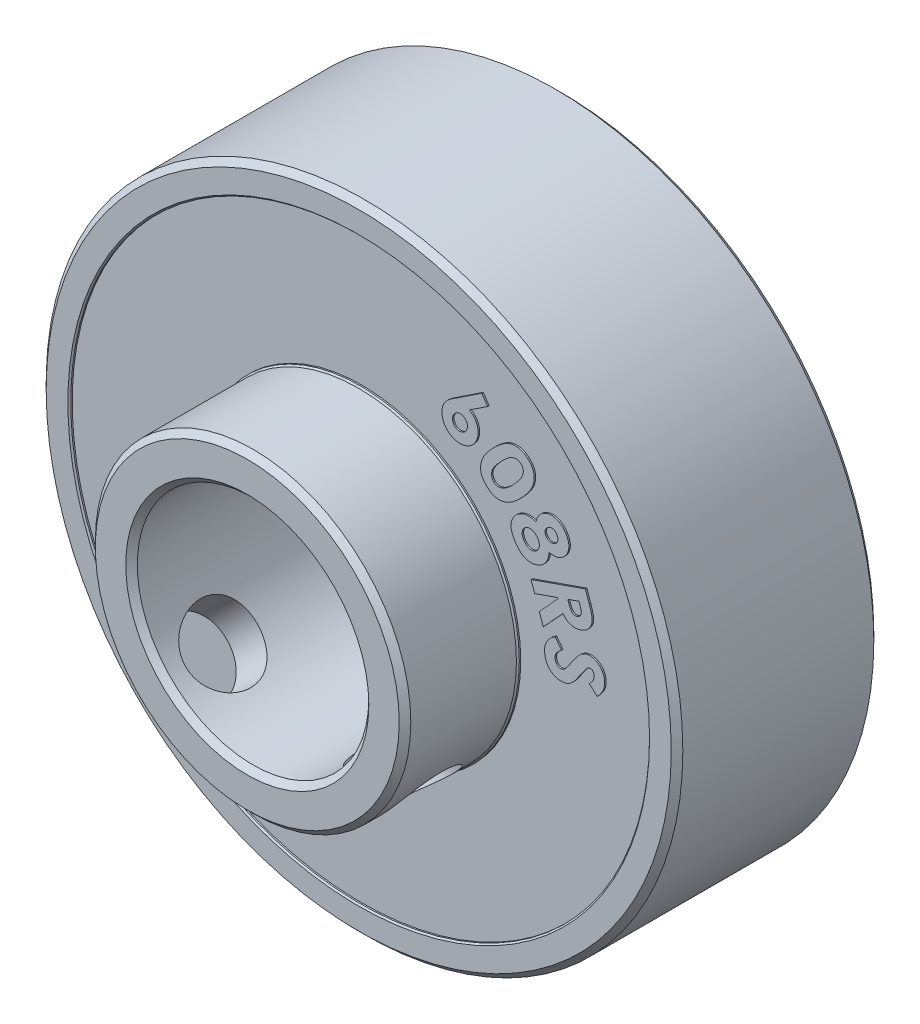
from build123d import *

# Parameters (mm, degrees)
SKETCH_1_R                      = 11
SKETCH_1_R_2                    = 4
EXTRUDE_1_DEPTH                 = 7
SKETCH_2_R                      = 10
SKETCH_2_R_2                    = 5.5
CUT_EXTRUDE_1_DEPTH             = 0.1
CUT_EXTRUDE_START               = -6.9
SKETCH_2_2_R                    = 10
SKETCH_2_2_R_2                  = 5.5
CUT_EXTRUDE_2_DEPTH             = 0.1
CHAMFER_1_SIZE                  = 0.05
SKETCH_3_R                      = 5.45
SKETCH_3_R_2                    = 4
EXTRUDE_2_DEPTH                 = 3.85
EXTRUDE_3_DEPTH                 = 0.05
EXTRUDE_4_DEPTH                 = 0.05
CHAMFER_2_SIZE                  = 0.2
HOLE_WIZARD_M31_D               = 2.5
HOLE_WIZARD_M31_DEPTH           = 5
HOLE_WIZARD_M31_TIP             = 0.751075774
HOLE_WIZARD_M31_ON_FACE_2_D     = 2.5
HOLE_WIZARD_M31_ON_FACE_2_DEPTH = 5
HOLE_WIZARD_M31_ON_FACE_2_TIP   = 0.751075774


with BuildPart() as part:
    # Эскиз1 → Бобышка-Вытянуть1 (new body)
    with BuildSketch(Plane.XY):
        Circle(SKETCH_1_R)
        Circle(SKETCH_1_R_2, mode=Mode.SUBTRACT)
    extrude(amount=EXTRUDE_1_DEPTH)

    # Эскиз2 → Вырез-Вытянуть1 (cut)
    with BuildSketch(Plane.XY.offset(7)):
        Circle(SKETCH_2_R)
        Circle(SKETCH_2_R_2, mode=Mode.SUBTRACT)
    extrude(amount=-CUT_EXTRUDE_1_DEPTH, mode=Mode.SUBTRACT)

    # Эскиз2<2> → Вырез-Вытянуть2 (cut)
    with BuildSketch(Plane.XY.offset(7).offset(CUT_EXTRUDE_START)):
        Circle(SKETCH_2_2_R)
        Circle(SKETCH_2_2_R_2, mode=Mode.SUBTRACT)
    extrude(amount=-CUT_EXTRUDE_2_DEPTH, mode=Mode.SUBTRACT)

    # Фаска1
    chamfer_1_edges = [part.edges().sort_by_distance(p)[0] for p in [
        (-10, 0, 7),
        (-5.5, 0, 7),
        (-10, 0, 0),
        (-5.5, 0, 0),
    ]]
    chamfer(chamfer_1_edges, length=CHAMFER_1_SIZE)

    # Эскиз3 → Бобышка-Вытянуть2 (add)
    with BuildSketch(Plane.XY.offset(7)):
        with Locations(Location((0, 0, 0), (0, 0, 180))):
            Circle(SKETCH_3_R)
        Circle(SKETCH_3_R_2, mode=Mode.SUBTRACT)
    extrude(amount=EXTRUDE_2_DEPTH)

    # Эскиз4 → Бобышка-Вытянуть3 (add)
    # profile 1 of 5: a face of its own
    with BuildSketch(Plane(origin=(0, 0, 0.1), x_dir=(-1, 0, 0), z_dir=(0, 0, -1))):
        with BuildLine():
            Line((8.19029949, 0.296762684), (7.915459746, 0.547964607))
            add(Edge.make_bspline(
                [(7.915459746, 0.547964607), (7.930212538, 0.561652705), (7.958620401, 0.5880104), (7.996327588, 0.629118684), (8.027634521, 0.669973123), (8.052746255, 0.710199301), (8.070948356, 0.750293238), (8.083411061, 0.789625849), (8.08946559, 0.828783287), (8.088037669, 0.854577687), (8.087334746, 0.867275505)],
                knots=[0, 0, 0, 0, 1.283643058, 2.471773221, 3.553897725, 4.563664135, 5.490235735, 6.35533973, 7.190382524, 8, 8, 8, 8], degree=3))
            add(Edge.make_bspline(
                [(8.087334746, 0.867275505), (8.085558773, 0.878973611), (8.082125644, 0.901587192), (8.071279685, 0.933093962), (8.055802359, 0.960805758), (8.03577539, 0.983623568), (8.013683645, 1.002156579), (7.990027468, 1.014988722), (7.965398511, 1.021989278), (7.948884251, 1.021409155), (7.940700131, 1.021121659)],
                knots=[0, 0, 0, 0, 1.207749352, 2.334697242, 3.386348666, 4.431866923, 5.42132409, 6.31922352, 7.167042535, 8, 8, 8, 8], degree=3))
            add(Edge.make_bspline(
                [(7.940700131, 1.021121659), (7.932621335, 1.019788328), (7.916352308, 1.017103275), (7.892835161, 1.008040019), (7.870663256, 0.994639244), (7.857349918, 0.983259209), (7.8505559, 0.977451787)],
                knots=[0, 0, 0, 0, 0.962820743, 1.938922399, 2.948197738, 4, 4, 4, 4], degree=3))
            add(Edge.make_bspline(
                [(7.8505559, 0.977451787), (7.84541126, 0.972172886), (7.833449413, 0.959898867), (7.814987093, 0.937231381), (7.792517843, 0.908811056), (7.766476502, 0.874109426), (7.736487579, 0.833524337), (7.703276191, 0.786289932), (7.666020447, 0.733319385), (7.640427557, 0.695574799), (7.626998208, 0.675769095)],
                knots=[0, 0, 0, 0, 0.470536925, 1.094049535, 1.865251957, 2.784627903, 3.864381354, 5.087794006, 6.471879073, 8, 8, 8, 8], degree=3))
            add(Edge.make_bspline(
                [(7.626998208, 0.675769095), (7.614640541, 0.657163929), (7.59117441, 0.62183434), (7.556915793, 0.572340715), (7.526894203, 0.528161762), (7.500632504, 0.48961279), (7.477330699, 0.457159711), (7.457614111, 0.430479971), (7.44217769, 0.408896208), (7.432465201, 0.396888513), (7.428280259, 0.391714607)],
                knots=[0, 0, 0, 0, 1.545917925, 2.935563431, 4.166209933, 5.243077074, 6.163962197, 6.931235012, 7.539487855, 8, 8, 8, 8], degree=3))
            add(Edge.make_bspline(
                [(7.428280259, 0.391714607), (7.4114759, 0.37182383), (7.379248179, 0.333676916), (7.328208941, 0.282837672), (7.277363857, 0.240609472), (7.226534591, 0.206027725), (7.174108624, 0.179103752), (7.119281824, 0.15825443), (7.061278872, 0.142730866), (7.021175822, 0.137275416), (7.000796284, 0.134503069)],
                knots=[0, 0, 0, 0, 1.216684991, 2.333381793, 3.361974081, 4.302038155, 5.200978211, 6.109832555, 7.039456128, 8, 8, 8, 8], degree=3))
            add(Edge.make_bspline(
                [(7.000796284, 0.134503069), (6.980912016, 0.132939575), (6.941838298, 0.12986722), (6.883982913, 0.131513012), (6.82825067, 0.138661818), (6.774544586, 0.151627333), (6.722756945, 0.169984056), (6.673281438, 0.194236918), (6.625975808, 0.223873764), (6.580966464, 0.258411534), (6.539486787, 0.297912458), (6.502409832, 0.341503294), (6.469838994, 0.388631019), (6.44154117, 0.439372329), (6.418347524, 0.49408404), (6.400061376, 0.552505823), (6.385829599, 0.614394453), (6.380248477, 0.657145995), (6.377398849, 0.678974223)],
                knots=[0, 0, 0, 0, 1.030268607, 2.024536377, 2.985077074, 3.929235972, 4.874504223, 5.819066673, 6.770888815, 7.755188857, 8.746217296, 9.725422457, 10.707590718, 11.702433264, 12.722899079, 13.772838986, 14.862848562, 16, 16, 16, 16], degree=3))
            add(Edge.make_bspline(
                [(6.377398849, 0.678974223), (6.375798997, 0.696321208), (6.372653038, 0.730432429), (6.372535986, 0.781177306), (6.375069038, 0.830462562), (6.381642251, 0.878375858), (6.391261519, 0.924960238), (6.403940592, 0.970331043), (6.420541605, 1.014242388), (6.440615795, 1.056859335), (6.464496118, 1.098276227), (6.491701076, 1.138889291), (6.523102827, 1.178239059), (6.558610982, 1.21622944), (6.597564644, 1.253669069), (6.640451848, 1.289953404), (6.686987923, 1.325474587), (6.720207941, 1.347309565), (6.73717449, 1.358461402)],
                knots=[0, 0, 0, 0, 1.024197967, 2.013989355, 2.98174725, 3.924932278, 4.855438404, 5.777986075, 6.692775885, 7.613415354, 8.545842579, 9.502280528, 10.486163035, 11.50337868, 12.558966263, 13.662340886, 14.806081068, 16, 16, 16, 16], degree=3))
            Line((6.73717449, 1.358461402), (6.961132823, 1.063589607))
            add(Edge.make_bspline(
                [(6.961132823, 1.063589607), (6.941783223, 1.04976002), (6.904640351, 1.023213188), (6.85527869, 0.979883822), (6.813922044, 0.936215765), (6.780990044, 0.891951698), (6.756355029, 0.847119192), (6.740509524, 0.801507386), (6.732160003, 0.755241067), (6.733901828, 0.724403811), (6.734770643, 0.7090223)],
                knots=[0, 0, 0, 0, 1.291115503, 2.478383912, 3.561174717, 4.552019659, 5.467235253, 6.327452426, 7.165739371, 8, 8, 8, 8], degree=3))
            add(Edge.make_bspline(
                [(6.734770643, 0.7090223), (6.737047017, 0.693544477), (6.741454544, 0.663576223), (6.756678186, 0.621468176), (6.778461183, 0.583906059), (6.806966887, 0.552326697), (6.838713363, 0.526585695), (6.873193107, 0.5093839), (6.908924688, 0.499647074), (6.93303441, 0.500608287), (6.945107182, 0.501089607)],
                knots=[0, 0, 0, 0, 1.144864229, 2.216693053, 3.261423878, 4.308950986, 5.319950067, 6.239695352, 7.118540031, 8, 8, 8, 8], degree=3))
            add(Edge.make_bspline(
                [(6.945107182, 0.501089607), (6.956297977, 0.502953883), (6.978992459, 0.50673456), (7.011813893, 0.520227563), (7.043931163, 0.539397657), (7.069731885, 0.560640774), (7.091417844, 0.581581651), (7.109058069, 0.602268001), (7.129286143, 0.626178242), (7.150790557, 0.654455491), (7.174432144, 0.686507292), (7.200054137, 0.722495214), (7.227281408, 0.762582694), (7.245640499, 0.790851961), (7.255203336, 0.805576787)],
                knots=[0, 0, 0, 0, 0.909333767, 1.844092184, 2.830712254, 3.906853886, 4.52164093, 5.251643528, 6.089918518, 7.038804142, 8.105700029, 9.291005529, 10.58894572, 12, 12, 12, 12], degree=3))
            add(Edge.make_bspline(
                [(7.255203336, 0.805576787), (7.273676701, 0.833547949), (7.309135378, 0.88723716), (7.361565684, 0.963513784), (7.411212619, 1.031981061), (7.457727497, 1.093115192), (7.501182872, 1.146904816), (7.541988013, 1.192995836), (7.579505878, 1.231717473), (7.624811187, 1.272495506), (7.680872882, 1.312783201), (7.749093256, 1.350896932), (7.819395634, 1.376597714), (7.867344655, 1.384303781), (7.891020643, 1.388108838)],
                knots=[0, 0, 0, 0, 1.354635275, 2.600152879, 3.740128057, 4.772053465, 5.704282852, 6.533881209, 7.258997855, 7.881984621, 8.994978827, 10.040768623, 11.032582161, 12, 12, 12, 12], degree=3))
            add(Edge.make_bspline(
                [(7.891020643, 1.388108838), (7.907837345, 1.389379919), (7.941058613, 1.391890929), (7.990627945, 1.389771243), (8.038890595, 1.382682444), (8.085784404, 1.369905718), (8.1315722, 1.352830166), (8.175904073, 1.330212525), (8.21850955, 1.302087689), (8.259844147, 1.270033589), (8.298457845, 1.234037671), (8.332687216, 1.194351501), (8.362795003, 1.152283012), (8.388809922, 1.107439648), (8.409857622, 1.05948486), (8.427255893, 1.009050899), (8.43972419, 0.955578355), (8.444613189, 0.918875245), (8.447110387, 0.900128069)],
                knots=[0, 0, 0, 0, 0.982658787, 1.941235034, 2.886113445, 3.821089462, 4.769842375, 5.731008605, 6.715886282, 7.742366117, 8.778049333, 9.788214007, 10.79299206, 11.790714915, 12.805102541, 13.84180981, 14.897641854, 16, 16, 16, 16], degree=3))
            add(Edge.make_bspline(
                [(8.447110387, 0.900128069), (8.448935719, 0.875698903), (8.452568899, 0.827074558), (8.446914222, 0.754085903), (8.432729231, 0.682042073), (8.413680399, 0.622888679), (8.393507869, 0.575406695), (8.374555687, 0.538716982), (8.352421563, 0.500825792), (8.326600844, 0.4621087), (8.297870618, 0.421941161), (8.265169611, 0.381074719), (8.229131565, 0.339066076), (8.203470577, 0.311111175), (8.19029949, 0.296762684)],
                knots=[0, 0, 0, 0, 1.297254647, 2.582083941, 3.866503492, 5.183090301, 5.868268373, 6.599732141, 7.370831279, 8.193636159, 9.066090408, 9.988293336, 10.967445722, 12, 12, 12, 12], degree=3))
        make_face()
    # profile 2 of 5: a face of its own
    with BuildSketch(Plane(origin=(0, 0, 0.1), x_dir=(-1, 0, 0), z_dir=(0, 0, -1))):
        with BuildLine():
            Line((7.783437326, 3.311270875), (7.916049505, 2.931863824))
            add(Edge.make_bspline(
                [(7.916049505, 2.931863824), (7.924769277, 2.906813762), (7.941572283, 2.858542271), (7.963024934, 2.788029468), (7.981292416, 2.722622896), (7.995695135, 2.662213175), (8.006872453, 2.606813373), (8.013669165, 2.556351502), (8.017163917, 2.510850173), (8.016823721, 2.469705288), (8.013181297, 2.4313611), (8.006195484, 2.394738008), (7.9970776, 2.358609232), (7.984653781, 2.323511961), (7.96914369, 2.289215094), (7.951395761, 2.255452582), (7.929654367, 2.223113567), (7.906410686, 2.190975053), (7.879929518, 2.160614922), (7.850983844, 2.132280666), (7.820175082, 2.105381599), (7.786052597, 2.081795139), (7.750622108, 2.058414709), (7.711991084, 2.038403077), (7.671445547, 2.019658329), (7.6431591, 2.00926096), (7.62878989, 2.003979209)],
                knots=[0, 0, 0, 0, 1.706955509, 3.289304765, 4.742725008, 6.076968942, 7.285589652, 8.378391958, 9.352075536, 10.220228812, 11.023312621, 11.827453633, 12.617553708, 13.419486802, 14.219759959, 15.038829142, 15.870829558, 16.725215705, 17.59038548, 18.459516813, 19.331194434, 20.218454335, 21.126861048, 22.061206263, 23.015113666, 24, 24, 24, 24], degree=3))
            add(Edge.make_bspline(
                [(7.62878989, 2.003979209), (7.613633286, 1.998940047), (7.58387039, 1.989044688), (7.538798529, 1.978394979), (7.494653902, 1.970684925), (7.451417635, 1.966152981), (7.40905723, 1.965274454), (7.3676703, 1.968216093), (7.327141762, 1.974045178), (7.287587328, 1.983779464), (7.249163118, 1.997053821), (7.211496131, 2.013653627), (7.174820214, 2.03367515), (7.138912407, 2.056937192), (7.104358371, 2.084204536), (7.070277885, 2.114486214), (7.037441286, 2.148719433), (7.016740509, 2.173330977), (7.006193736, 2.185870234)],
                knots=[0, 0, 0, 0, 1.096708063, 2.153596337, 3.177645909, 4.173531218, 5.136944437, 6.084015114, 7.02072131, 7.946310815, 8.877565628, 9.809949373, 10.770519432, 11.745049659, 12.745151267, 13.791154223, 14.874622174, 16, 16, 16, 16], degree=3))
            Line((7.006193736, 2.185870234), (6.326305916, 1.449091388))
            Line((6.326305916, 1.449091388), (6.189687326, 1.839716388))
            Line((6.189687326, 1.839716388), (6.837123223, 2.541639465))
            Line((6.837123223, 2.541639465), (6.825504634, 2.574492029))
            Line((6.825504634, 2.574492029), (6.029831557, 2.295645875))
            Line((6.029831557, 2.295645875), (5.904831557, 2.653418311))
            Line((5.904831557, 2.653418311), (7.783437326, 3.311270875))
        make_face()
        with BuildLine():
            Line((7.174062326, 2.696286901), (7.213725787, 2.584107414))
            add(Edge.make_bspline(
                [(7.213725787, 2.584107414), (7.218691825, 2.570443194), (7.228199165, 2.544283427), (7.243590818, 2.507335062), (7.25855833, 2.473783305), (7.274594183, 2.444335865), (7.290510547, 2.418541625), (7.306626959, 2.39661665), (7.322900646, 2.378338402), (7.340039177, 2.364089402), (7.357804561, 2.352860045), (7.376557924, 2.344495657), (7.396509399, 2.338777176), (7.417431195, 2.335993291), (7.439480594, 2.33620775), (7.462604378, 2.33850186), (7.486837126, 2.343916635), (7.503026628, 2.349069729), (7.511402069, 2.351735619)],
                knots=[0, 0, 0, 0, 1.601891661, 3.066776947, 4.410195398, 5.648149463, 6.758846487, 7.747826659, 8.643734474, 9.448322519, 10.195548691, 10.953137507, 11.703112172, 12.475283592, 13.269985724, 14.128109779, 15.031600479, 16, 16, 16, 16], degree=3))
            add(Edge.make_bspline(
                [(7.511402069, 2.351735619), (7.521147096, 2.35559951), (7.540209085, 2.363157563), (7.566074549, 2.378945612), (7.588463677, 2.398071694), (7.607385114, 2.420242858), (7.622629573, 2.444952802), (7.633390541, 2.471694709), (7.640549153, 2.499855194), (7.642219977, 2.524775568), (7.641954507, 2.546526319), (7.639054197, 2.565454062), (7.635740431, 2.587201882), (7.629849179, 2.61128605), (7.623047983, 2.638033071), (7.614660766, 2.667347576), (7.60409895, 2.699141683), (7.596615811, 2.721264102), (7.592732198, 2.732745234)],
                knots=[0, 0, 0, 0, 1.127833703, 2.206125587, 3.247006354, 4.287887121, 5.334123575, 6.360081624, 7.382502748, 8.450668697, 9.040729981, 9.722428417, 10.510067932, 11.410520644, 12.39108699, 13.483965865, 14.694224073, 16, 16, 16, 16], degree=3))
            Line((7.592732198, 2.732745234), (7.558277069, 2.830902286))
            Line((7.558277069, 2.830902286), (7.174062326, 2.696286901))
        make_face(mode=Mode.SUBTRACT)
    # profile 3 of 5: a face of its own
    with BuildSketch(Plane(origin=(0, 0, 0.1), x_dir=(-1, 0, 0), z_dir=(0, 0, -1))):
        with BuildLine():
            add(Edge.make_bspline(
                [(6.524956198, 3.777500663), (6.524304606, 3.75126623), (6.523019287, 3.69951662), (6.509214831, 3.623469832), (6.486888654, 3.550377208), (6.454692656, 3.481106031), (6.414135167, 3.416737269), (6.366520042, 3.357464227), (6.311106445, 3.304622347), (6.269210325, 3.275126123), (6.24811325, 3.260273099)],
                knots=[0, 0, 0, 0, 1.027340805, 2.026515475, 3.018313015, 4.016060567, 5.010961512, 5.993641018, 6.989684333, 8, 8, 8, 8], degree=3))
            add(Edge.make_bspline(
                [(6.24811325, 3.260273099), (6.224201635, 3.24561151), (6.17684081, 3.216571858), (6.099236998, 3.186803655), (6.01938164, 3.165575641), (5.937038073, 3.156819994), (5.855027357, 3.158202871), (5.775198976, 3.170467796), (5.699052471, 3.194578876), (5.638722513, 3.223379802), (5.592328757, 3.251989183), (5.558324524, 3.277540386), (5.524468605, 3.306017131), (5.491500637, 3.338079993), (5.458736035, 3.37313351), (5.426897068, 3.411715615), (5.394976108, 3.453295723), (5.375210263, 3.483040176), (5.365100429, 3.498253869)],
                knots=[0, 0, 0, 0, 1.303214694, 2.581227698, 3.852387222, 5.141062064, 6.422020446, 7.661855004, 8.886870759, 10.127110528, 10.763715695, 11.421492558, 12.105285765, 12.821976999, 13.560998413, 14.337908647, 15.149873567, 16, 16, 16, 16], degree=3))
            add(Edge.make_bspline(
                [(5.365100429, 3.498253869), (5.354502757, 3.514704801), (5.333927015, 3.546644847), (5.306890227, 3.595047921), (5.282338511, 3.641528806), (5.262354463, 3.687127168), (5.244439697, 3.730923542), (5.231573515, 3.773839499), (5.221254139, 3.81509366), (5.212673344, 3.868081762), (5.210257913, 3.933529132), (5.218138208, 4.011453013), (5.23833589, 4.088242466), (5.269077889, 4.163401809), (5.310608357, 4.23497626), (5.362631133, 4.300895298), (5.424017297, 4.360800087), (5.47130671, 4.394041983), (5.495308762, 4.410914125)],
                knots=[0, 0, 0, 0, 0.898227396, 1.743939131, 2.544713256, 3.310472017, 4.028938821, 4.715510003, 5.365398198, 5.980299854, 7.176961092, 8.360591663, 9.563707498, 10.809381662, 12.078734392, 13.349508007, 14.654725381, 16, 16, 16, 16], degree=3))
            add(Edge.make_bspline(
                [(5.495308762, 4.410914125), (5.517046647, 4.42416132), (5.559907764, 4.450281137), (5.628614186, 4.479326872), (5.698842436, 4.500288226), (5.771076481, 4.511315454), (5.845080326, 4.51387535), (5.920712713, 4.506597977), (5.998241639, 4.491231127), (6.049031122, 4.47388316), (6.075036327, 4.465000663)],
                knots=[0, 0, 0, 0, 1.00787022, 1.987242288, 2.947077545, 3.906153439, 4.875401634, 5.874657719, 6.911783381, 8, 8, 8, 8], degree=3))
            add(Edge.make_bspline(
                [(6.075036327, 4.465000663), (6.079748712, 4.485000462), (6.08900671, 4.524292258), (6.108878062, 4.580592191), (6.132866916, 4.633167242), (6.161056962, 4.68208808), (6.193554197, 4.727069924), (6.23039082, 4.768198609), (6.271094728, 4.805929575), (6.30165577, 4.82700098), (6.317023506, 4.837596817)],
                knots=[0, 0, 0, 0, 1.080470016, 2.122701697, 3.135136799, 4.117374167, 5.08859185, 6.049074693, 7.018969745, 8, 8, 8, 8], degree=3))
            add(Edge.make_bspline(
                [(6.317023506, 4.837596817), (6.338621255, 4.850591328), (6.381279936, 4.876257369), (6.450042003, 4.904438052), (6.521125204, 4.922536534), (6.593761558, 4.931015777), (6.66658219, 4.929470684), (6.738206504, 4.917758792), (6.807993188, 4.89585596), (6.875130473, 4.86347001), (6.939734421, 4.822231048), (6.999368558, 4.770616513), (7.055561568, 4.710751211), (7.087231726, 4.664839989), (7.103481839, 4.641282715)],
                knots=[0, 0, 0, 0, 0.997889349, 1.970975918, 2.932492279, 3.896932359, 4.860471542, 5.809804719, 6.763994604, 7.748871042, 8.756037824, 9.792283038, 10.867209569, 12, 12, 12, 12], degree=3))
            add(Edge.make_bspline(
                [(7.103481839, 4.641282715), (7.118266706, 4.617313906), (7.147135927, 4.570511938), (7.178984369, 4.496086455), (7.201762696, 4.421603302), (7.212798322, 4.346671449), (7.21415521, 4.272579683), (7.205418076, 4.199672689), (7.185759495, 4.128747746), (7.156971958, 4.060319699), (7.119520913, 3.996303386), (7.074614409, 3.93771315), (7.021994485, 3.885977177), (6.981835267, 3.857510527), (6.961654916, 3.843205792)],
                knots=[0, 0, 0, 0, 1.117294016, 2.181650263, 3.205496746, 4.203313101, 5.179532074, 6.141507601, 7.109258008, 8.093515385, 9.082507538, 10.047010183, 11.018605923, 12, 12, 12, 12], degree=3))
            add(Edge.make_bspline(
                [(6.961654916, 3.843205792), (6.946865794, 3.834091177), (6.917520408, 3.816005458), (6.871055379, 3.794448162), (6.823354409, 3.778282963), (6.773824196, 3.767141239), (6.720213606, 3.76162371), (6.660932763, 3.761454913), (6.594959848, 3.767025459), (6.549092294, 3.773888987), (6.524956198, 3.777500663)],
                knots=[0, 0, 0, 0, 0.918312471, 1.822165875, 2.702300176, 3.578058076, 4.501680321, 5.547167614, 6.70928807, 8, 8, 8, 8], degree=3))
        make_face()
        with BuildLine():
            add(Edge.make_bspline(
                [(6.792985044, 4.452180151), (6.784193133, 4.46416284), (6.767096261, 4.487464544), (6.734901369, 4.515655868), (6.698260579, 4.535858726), (6.658209729, 4.547577881), (6.616386986, 4.551923369), (6.57431036, 4.546702239), (6.532477779, 4.533439362), (6.506928956, 4.51817378), (6.493706198, 4.510273099)],
                knots=[0, 0, 0, 0, 1.042245895, 2.026765742, 2.980375271, 3.960320729, 4.940985148, 5.914300286, 6.920549047, 8, 8, 8, 8], degree=3))
            add(Edge.make_bspline(
                [(6.493706198, 4.510273099), (6.481273951, 4.501259963), (6.457078344, 4.483718619), (6.428218724, 4.449879888), (6.406350839, 4.411948623), (6.393096116, 4.370141725), (6.387590231, 4.326853426), (6.39146996, 4.283978738), (6.403334912, 4.24191666), (6.418307167, 4.216723511), (6.425997865, 4.203782715)],
                knots=[0, 0, 0, 0, 1.050136953, 2.043773826, 3.024360851, 4.035412181, 5.031916455, 5.997323732, 6.971298728, 8, 8, 8, 8], degree=3))
            add(Edge.make_bspline(
                [(6.425997865, 4.203782715), (6.435011379, 4.191354446), (6.45244255, 4.167319505), (6.485892403, 4.138647115), (6.523427725, 4.117682381), (6.564854226, 4.105334124), (6.608250747, 4.101721075), (6.65195102, 4.107155926), (6.695508259, 4.121394594), (6.722213073, 4.137380449), (6.736094019, 4.145689766)],
                knots=[0, 0, 0, 0, 1.038512025, 2.008370975, 2.961327375, 3.935787341, 4.91758916, 5.894068385, 6.905353861, 8, 8, 8, 8], degree=3))
            add(Edge.make_bspline(
                [(6.736094019, 4.145689766), (6.748494201, 4.15472618), (6.772393198, 4.172142151), (6.801283613, 4.205039318), (6.821620674, 4.242147084), (6.833728295, 4.282699071), (6.837325661, 4.325259879), (6.832037499, 4.368536184), (6.817067328, 4.411608544), (6.801236238, 4.438279303), (6.792985044, 4.452180151)],
                knots=[0, 0, 0, 0, 1.049071613, 2.02188637, 2.97209824, 3.927539907, 4.901086152, 5.878410172, 6.8942235, 8, 8, 8, 8], degree=3))
        make_face(mode=Mode.SUBTRACT)
        with BuildLine():
            add(Edge.make_bspline(
                [(6.136334403, 4.004664125), (6.13009776, 4.013874061), (6.11785514, 4.031953296), (6.096760064, 4.056514476), (6.074306033, 4.078383855), (6.050915758, 4.098498769), (6.025737138, 4.11559388), (5.998998784, 4.130127408), (5.971014648, 4.142231902), (5.941785246, 4.151195914), (5.912521492, 4.158134596), (5.883498299, 4.161892425), (5.855199959, 4.161970264), (5.827551938, 4.160548685), (5.800857083, 4.154321839), (5.774739409, 4.146706669), (5.749492095, 4.135210911), (5.733721651, 4.125435627), (5.725677352, 4.120449381)],
                knots=[0, 0, 0, 0, 1.124817388, 2.208032344, 3.268759496, 4.294831262, 5.325608786, 6.341574749, 7.370756504, 8.405071366, 9.431143132, 10.411710123, 11.357773941, 12.292672367, 13.204429581, 14.1234686, 15.042805637, 16, 16, 16, 16], degree=3))
            add(Edge.make_bspline(
                [(5.725677352, 4.120449381), (5.717529274, 4.114883698), (5.701561999, 4.10397698), (5.68010388, 4.084700625), (5.660992867, 4.064096017), (5.644205352, 4.041736022), (5.630411043, 4.017670084), (5.618371377, 3.992225053), (5.609936395, 3.96474385), (5.600554267, 3.926611276), (5.597012573, 3.876636245), (5.605317848, 3.815990821), (5.62666386, 3.755396987), (5.649123685, 3.717717789), (5.660773506, 3.69817374)],
                knots=[0, 0, 0, 0, 0.741926806, 1.453907122, 2.165177658, 2.854668687, 3.552822827, 4.249890908, 4.968227687, 5.711786598, 7.203414907, 8.704461029, 10.29061715, 12, 12, 12, 12], degree=3))
            add(Edge.make_bspline(
                [(5.660773506, 3.69817374), (5.667419067, 3.688432773), (5.68032333, 3.669517893), (5.701990641, 3.643861805), (5.723720515, 3.620157861), (5.747571594, 3.600482521), (5.771764178, 3.582691541), (5.797441383, 3.568450996), (5.823982749, 3.55672109), (5.859996585, 3.545016882), (5.906140241, 3.537875307), (5.961513481, 3.541793389), (6.016185928, 3.556831626), (6.048970267, 3.576358158), (6.065821583, 3.586394894)],
                knots=[0, 0, 0, 0, 0.898110874, 1.743939712, 2.557551234, 3.344755697, 4.096134693, 4.843573406, 5.577372218, 6.304860648, 7.72571922, 9.102920365, 10.510886413, 12, 12, 12, 12], degree=3))
            add(Edge.make_bspline(
                [(6.065821583, 3.586394894), (6.074104374, 3.592094128), (6.090343606, 3.603268041), (6.112047838, 3.62282216), (6.131556168, 3.643732013), (6.148263617, 3.666508804), (6.162537936, 3.690928681), (6.17409487, 3.716856498), (6.182971535, 3.744550922), (6.191374447, 3.783030953), (6.195208405, 3.832665775), (6.187873983, 3.892196313), (6.168263984, 3.950564247), (6.147169347, 3.986305941), (6.136334403, 4.004664125)],
                knots=[0, 0, 0, 0, 0.763890001, 1.497682027, 2.216418851, 2.93551438, 3.640997123, 4.363883981, 5.089761223, 5.848774416, 7.356060518, 8.850114758, 10.382108777, 12, 12, 12, 12], degree=3))
        make_face(mode=Mode.SUBTRACT)
    # profile 4 of 5: a face of its own
    with BuildSketch(Plane(origin=(0, 0, 0.1), x_dir=(-1, 0, 0), z_dir=(0, 0, -1))):
        with BuildLine():
            add(Edge.make_bspline(
                [(5.801031456, 6.207524346), (5.813924149, 6.19516843), (5.839258812, 6.170888556), (5.873240427, 6.131552721), (5.904337569, 6.091732955), (5.931202969, 6.050203969), (5.954578485, 6.00765238), (5.974175214, 5.963941836), (5.990412551, 5.919122663), (6.002811928, 5.87316911), (6.011288642, 5.825990893), (6.015662793, 5.777736132), (6.016039892, 5.728424058), (6.012315001, 5.678071857), (6.004775946, 5.626596852), (5.992439913, 5.574248861), (5.976901865, 5.52061597), (5.956647666, 5.465884361), (5.931706733, 5.409648841), (5.901395785, 5.351538184), (5.865064267, 5.291571875), (5.823556266, 5.229131962), (5.77584573, 5.164993724), (5.723039625, 5.09838208), (5.664069155, 5.030090285), (5.62220254, 4.984521939), (5.600710943, 4.961130116)],
                knots=[0, 0, 0, 0, 0.896879839, 1.762405055, 2.609389887, 3.433985627, 4.244867897, 5.046870708, 5.838672706, 6.637975543, 7.435699174, 8.244384643, 9.06985378, 9.910888981, 10.779297254, 11.681184557, 12.61131757, 13.583728112, 14.611264553, 15.700852567, 16.874782266, 18.133001721, 19.467173721, 20.890456197, 22.403762549, 24, 24, 24, 24], degree=3))
            add(Edge.make_bspline(
                [(5.600710943, 4.961130116), (5.578574221, 4.937730565), (5.53553699, 4.8922382), (5.470143519, 4.828685195), (5.406915097, 4.770678283), (5.345118899, 4.719024874), (5.285373377, 4.672743209), (5.227523425, 4.631969579), (5.170803391, 4.598001666), (5.116096466, 4.569016085), (5.06243213, 4.546170599), (5.010713129, 4.525910001), (4.959664435, 4.510976756), (4.909849023, 4.49902272), (4.861076695, 4.491450342), (4.813389159, 4.487710773), (4.766869748, 4.488076327), (4.72128448, 4.492499047), (4.676621178, 4.500918166), (4.632577225, 4.513575497), (4.588958731, 4.529896866), (4.545809118, 4.550660242), (4.503112836, 4.575039305), (4.460701317, 4.603269861), (4.419014914, 4.635790627), (4.392360922, 4.659940842), (4.378755815, 4.672267936)],
                knots=[0, 0, 0, 0, 1.62553563, 3.160293989, 4.601160432, 5.955180386, 7.223786167, 8.414819195, 9.52450069, 10.558549837, 11.536513283, 12.466596714, 13.360084421, 14.218407688, 15.050610811, 15.848251286, 16.630130654, 17.395360827, 18.156782084, 18.920586139, 19.705509938, 20.50443085, 21.334584377, 22.185145146, 23.073636135, 24, 24, 24, 24], degree=3))
            add(Edge.make_bspline(
                [(4.378755815, 4.672267936), (4.365634432, 4.685061046), (4.339843255, 4.710206974), (4.304648643, 4.750063775), (4.272741847, 4.79028845), (4.245499753, 4.831912791), (4.221613223, 4.874121738), (4.20164739, 4.917262906), (4.185365472, 4.961289792), (4.173362624, 5.006229307), (4.165360005, 5.052232285), (4.161057919, 5.099112779), (4.159946093, 5.147101322), (4.164134458, 5.19604944), (4.170472007, 5.246243105), (4.182172222, 5.297251014), (4.196962286, 5.349286742), (4.21546285, 5.402866783), (4.239285853, 5.457901636), (4.268834207, 5.514908125), (4.303815023, 5.574323931), (4.344730164, 5.635979916), (4.39190103, 5.699589283), (4.444457346, 5.765806637), (4.502875575, 5.834210328), (4.544736781, 5.879668888), (4.566255815, 5.903037167)],
                knots=[0, 0, 0, 0, 0.93145521, 1.830853238, 2.701521204, 3.539567412, 4.357371131, 5.165476893, 5.953858164, 6.741156795, 7.527048697, 8.324992091, 9.133126379, 9.96376784, 10.820341906, 11.703392463, 12.621159873, 13.570315713, 14.583154331, 15.667295202, 16.832996866, 18.087234292, 19.427652897, 20.858187109, 22.384929949, 24, 24, 24, 24], degree=3))
            add(Edge.make_bspline(
                [(4.566255815, 5.903037167), (4.596827081, 5.934964931), (4.655824296, 5.996579952), (4.745593631, 6.081166655), (4.832620022, 6.155531077), (4.917492881, 6.218720737), (4.999409849, 6.27248489), (5.079241472, 6.314911903), (5.156191022, 6.348236977), (5.208016495, 6.361707711), (5.232922482, 6.368181398)],
                knots=[0, 0, 0, 0, 1.287451315, 2.484556693, 3.591331551, 4.619887002, 5.565116891, 6.442227226, 7.251374558, 8, 8, 8, 8], degree=3))
            add(Edge.make_bspline(
                [(5.232922482, 6.368181398), (5.259279446, 6.373132216), (5.311020478, 6.382851106), (5.38873757, 6.385634438), (5.464011498, 6.379965509), (5.536719427, 6.36406757), (5.60708657, 6.338928427), (5.675008317, 6.30461439), (5.740730452, 6.261103079), (5.78060957, 6.225669629), (5.801031456, 6.207524346)],
                knots=[0, 0, 0, 0, 1.043642178, 2.048761185, 3.019736125, 3.97808078, 4.939232424, 5.92356981, 6.936671029, 8, 8, 8, 8], degree=3))
        make_face()
        with BuildLine():
            add(Edge.make_bspline(
                [(5.561448123, 5.937892936), (5.54949212, 5.948094367), (5.526055929, 5.968091241), (5.48526411, 5.990222344), (5.441166125, 6.004103016), (5.40219865, 6.00973176), (5.369591787, 6.010643547), (5.343747909, 6.007364632), (5.316691723, 6.002411823), (5.288853121, 5.993630665), (5.259641396, 5.982944659), (5.229805065, 5.968561691), (5.198284581, 5.952284519), (5.165827919, 5.932324526), (5.131501983, 5.909533566), (5.095831072, 5.882268356), (5.057770723, 5.851541594), (5.017762092, 5.816430382), (4.97530072, 5.777819734), (4.931290096, 5.734585593), (4.884755595, 5.687887076), (4.853570697, 5.654849218), (4.837489789, 5.637812808)],
                knots=[0, 0, 0, 0, 1.078457542, 2.113995491, 3.165252164, 4.24183154, 4.8112373, 5.402439376, 6.029159191, 6.700255689, 7.406374243, 8.166383653, 8.9755623, 9.844875258, 10.784663416, 11.807625589, 12.93055478, 14.147713473, 15.467127592, 16.876286332, 18.389215538, 20, 20, 20, 20], degree=3))
            add(Edge.make_bspline(
                [(4.837489789, 5.637812808), (4.817040713, 5.615509933), (4.777765071, 5.572673781), (4.72358216, 5.508851829), (4.676000212, 5.448681173), (4.636315581, 5.39120832), (4.603214592, 5.337542892), (4.576727967, 5.287418759), (4.557496626, 5.240503726), (4.545677609, 5.196541141), (4.539589736, 5.155502193), (4.537998194, 5.116969893), (4.54005798, 5.080309837), (4.547439043, 5.045872129), (4.558631271, 5.013497936), (4.574165414, 4.983227409), (4.594136837, 4.955123298), (4.610485374, 4.938615556), (4.618739789, 4.930280757)],
                knots=[0, 0, 0, 0, 1.764330829, 3.388672662, 4.881067554, 6.235525549, 7.458945136, 8.556138335, 9.538053795, 10.408906489, 11.204079648, 11.952336581, 12.654775104, 13.339019898, 13.999083847, 14.646906155, 15.316819627, 16, 16, 16, 16], degree=3))
            add(Edge.make_bspline(
                [(4.618739789, 4.930280757), (4.627241972, 4.922969808), (4.643986105, 4.908571683), (4.671887381, 4.891244126), (4.701417265, 4.878239617), (4.732609899, 4.869779355), (4.765527544, 4.865754705), (4.799954191, 4.866443213), (4.836028136, 4.870687125), (4.859985852, 4.876962951), (4.872345559, 4.880200628)],
                knots=[0, 0, 0, 0, 0.990256165, 1.950202826, 2.891302884, 3.833661247, 4.797304066, 5.812790631, 6.87162592, 8, 8, 8, 8], degree=3))
            add(Edge.make_bspline(
                [(4.872345559, 4.880200628), (4.888239843, 4.885466484), (4.921729172, 4.896561665), (4.971713666, 4.921276575), (5.02428298, 4.952714721), (5.079174526, 4.991458443), (5.136493986, 5.0374372), (5.196364395, 5.090401555), (5.259185568, 5.150147434), (5.300431109, 5.193703881), (5.321864789, 5.216338449)],
                knots=[0, 0, 0, 0, 0.707909902, 1.491569345, 2.353275058, 3.298764867, 4.332382232, 5.461687153, 6.680938905, 8, 8, 8, 8], degree=3))
            add(Edge.make_bspline(
                [(5.321864789, 5.216338449), (5.343122606, 5.23943443), (5.384079707, 5.283933093), (5.440429588, 5.350152791), (5.48954109, 5.412895734), (5.53175079, 5.471472335), (5.566683898, 5.526595246), (5.593991726, 5.578177571), (5.614630273, 5.626023181), (5.627649962, 5.67078917), (5.634880992, 5.71248432), (5.63789165, 5.751686534), (5.636437143, 5.788568573), (5.630412955, 5.823218701), (5.619901141, 5.855597497), (5.605110815, 5.8858054), (5.585535276, 5.913595223), (5.569573787, 5.92969624), (5.561448123, 5.937892936)],
                knots=[0, 0, 0, 0, 1.790505423, 3.449738563, 4.958437556, 6.334645182, 7.566924544, 8.677841254, 9.661171365, 10.533905407, 11.33046538, 12.071346386, 12.772877167, 13.430424381, 14.071254209, 14.708360098, 15.342452786, 16, 16, 16, 16], degree=3))
        make_face(mode=Mode.SUBTRACT)
    # profile 5 of 5: a face of its own
    with BuildSketch(Plane(origin=(0, 0, 0.1), x_dir=(-1, 0, 0), z_dir=(0, 0, -1))):
        with BuildLine():
            Line((4.204330023, 7.378835528), (4.405451818, 7.080758605))
            Line((4.405451818, 7.080758605), (3.771237074, 6.662489374))
            add(Edge.make_bspline(
                [(3.771237074, 6.662489374), (3.788948954, 6.651870835), (3.823829351, 6.63095951), (3.871823477, 6.594203067), (3.914749666, 6.553410061), (3.953715543, 6.509517197), (3.986416935, 6.460769843), (4.015222891, 6.40891339), (4.038725909, 6.352970088), (4.057443164, 6.294120739), (4.070599254, 6.233620565), (4.07790034, 6.172716553), (4.079228374, 6.112171987), (4.073970464, 6.0518571), (4.062070404, 5.992103974), (4.044788927, 5.932359507), (4.021322095, 5.872886796), (4.000800903, 5.834840366), (3.990387715, 5.815534246)],
                knots=[0, 0, 0, 0, 1.01594452, 2.000722089, 2.967966702, 3.927721352, 4.883143816, 5.851102988, 6.843747715, 7.864529688, 8.887003591, 9.886654211, 10.879473055, 11.86266964, 12.86052468, 13.873658011, 14.921017937, 16, 16, 16, 16], degree=3))
            add(Edge.make_bspline(
                [(3.990387715, 5.815534246), (3.979568037, 5.797236083), (3.958268039, 5.761213677), (3.919849288, 5.712481993), (3.879388109, 5.667394465), (3.833755664, 5.628444703), (3.784983061, 5.593781209), (3.73206478, 5.564504211), (3.675710328, 5.540006158), (3.616435273, 5.520513129), (3.55566895, 5.506662972), (3.49478542, 5.498297041), (3.434642606, 5.496979323), (3.375145197, 5.500703819), (3.3164849, 5.511318428), (3.258456363, 5.527984367), (3.200973239, 5.550158103), (3.164349044, 5.56968588), (3.145836433, 5.579556682)],
                knots=[0, 0, 0, 0, 1.044355035, 2.055954016, 3.046108564, 4.01929933, 4.999711365, 5.984732998, 6.987787716, 8.018022592, 9.048927268, 10.04939801, 11.034988855, 12.002756169, 12.976810999, 13.960232698, 14.968948864, 16, 16, 16, 16], degree=3))
            add(Edge.make_bspline(
                [(3.145836433, 5.579556682), (3.126900784, 5.590809206), (3.089767666, 5.612875592), (3.038915686, 5.651766519), (2.993641834, 5.694377274), (2.95302519, 5.74017481), (2.918424422, 5.790325388), (2.88925237, 5.844140103), (2.864931095, 5.901520205), (2.846519572, 5.961864927), (2.833250825, 6.023391038), (2.826203937, 6.084577253), (2.823872151, 6.144498742), (2.827810032, 6.203211252), (2.838212101, 6.260531864), (2.853173011, 6.316772679), (2.874548952, 6.371671255), (2.892952523, 6.406512466), (2.90224669, 6.424107964)],
                knots=[0, 0, 0, 0, 1.081888934, 2.121601975, 3.138545199, 4.133886447, 5.124368109, 6.125944256, 7.137769764, 8.18205145, 9.222220187, 10.226867113, 11.205402434, 12.165941497, 13.112315172, 14.064475316, 15.022521888, 16, 16, 16, 16], degree=3))
            add(Edge.make_bspline(
                [(2.90224669, 6.424107964), (2.910044621, 6.437334588), (2.925715714, 6.46391544), (2.953261568, 6.501442495), (2.983354204, 6.537701428), (3.011312844, 6.566804718), (3.036983313, 6.590155052), (3.059591344, 6.609655966), (3.085863372, 6.630529392), (3.11551908, 6.652972296), (3.148943875, 6.67691527), (3.185556775, 6.70305142), (3.226129647, 6.730085917), (3.25426887, 6.748639551), (3.268833228, 6.758242579)],
                knots=[0, 0, 0, 0, 1.101910966, 2.214452613, 3.337892719, 4.484022691, 5.108442505, 5.829247805, 6.627479611, 7.517388936, 8.499500422, 9.579708563, 10.74730053, 12, 12, 12, 12], degree=3))
            Line((3.268833228, 6.758242579), (4.204330023, 7.378835528))
        make_face()
        with BuildLine():
            add(Edge.make_bspline(
                [(3.576926177, 6.361607964), (3.561709724, 6.369292664), (3.532055196, 6.384268964), (3.483253287, 6.394005894), (3.433831049, 6.394320254), (3.384691225, 6.382882802), (3.337565185, 6.363314648), (3.295005729, 6.334070127), (3.257806818, 6.296313051), (3.238891001, 6.265873356), (3.229169766, 6.250229759)],
                knots=[0, 0, 0, 0, 1.000533138, 1.94988536, 2.902234447, 3.893374452, 4.902047154, 5.893155908, 6.917248627, 8, 8, 8, 8], degree=3))
            add(Edge.make_bspline(
                [(3.229169766, 6.250229759), (3.220864632, 6.233808281), (3.204656611, 6.201760679), (3.192372983, 6.14967388), (3.189723737, 6.097047863), (3.197899343, 6.045124659), (3.214835188, 5.996428523), (3.239947163, 5.953633769), (3.272607071, 5.917359646), (3.299623629, 5.900030568), (3.313304382, 5.8912554)],
                knots=[0, 0, 0, 0, 1.076981574, 2.101800953, 3.114161618, 4.153007014, 5.167065966, 6.122976348, 7.049505219, 8, 8, 8, 8], degree=3))
            add(Edge.make_bspline(
                [(3.313304382, 5.8912554), (3.328526115, 5.883591915), (3.358567236, 5.868467508), (3.408033862, 5.858449103), (3.4586791, 5.857922848), (3.509402985, 5.8681622), (3.558258303, 5.887520741), (3.602435839, 5.916631075), (3.640929569, 5.954859328), (3.660318308, 5.985894159), (3.670275536, 6.001832323)],
                knots=[0, 0, 0, 0, 0.979454186, 1.933019191, 2.880745447, 3.885599153, 4.898572784, 5.894406185, 6.918656956, 8, 8, 8, 8], degree=3))
            add(Edge.make_bspline(
                [(3.670275536, 6.001832323), (3.678752492, 6.018239556), (3.695271373, 6.050212012), (3.707306685, 6.101994707), (3.710298487, 6.153863375), (3.701312052, 6.204786773), (3.684345201, 6.253330727), (3.656920121, 6.296211227), (3.621686509, 6.334004176), (3.592121677, 6.352236867), (3.576926177, 6.361607964)],
                knots=[0, 0, 0, 0, 1.063904892, 2.073210741, 3.047110242, 4.048560298, 5.042602281, 6.000113883, 6.972114167, 8, 8, 8, 8], degree=3))
        make_face(mode=Mode.SUBTRACT)
    extrude(amount=EXTRUDE_3_DEPTH)

    # Эскиз6 → Бобышка-Вытянуть4 (add)
    # profile 1 of 5: a face of its own
    with BuildSketch(Plane.XY.offset(6.9)):
        with BuildLine():
            Line((8.19029949, 0.296762684), (7.915459746, 0.547964607))
            add(Edge.make_bspline(
                [(7.915459746, 0.547964607), (7.930212538, 0.561652705), (7.958620401, 0.5880104), (7.996327588, 0.629118684), (8.027634521, 0.669973123), (8.052746255, 0.710199301), (8.070948356, 0.750293238), (8.083411061, 0.789625849), (8.08946559, 0.828783287), (8.088037669, 0.854577687), (8.087334746, 0.867275505)],
                knots=[0, 0, 0, 0, 1.283643058, 2.471773221, 3.553897725, 4.563664135, 5.490235735, 6.35533973, 7.190382524, 8, 8, 8, 8], degree=3))
            add(Edge.make_bspline(
                [(8.087334746, 0.867275505), (8.085558773, 0.878973611), (8.082125644, 0.901587192), (8.071279685, 0.933093962), (8.055802359, 0.960805758), (8.03577539, 0.983623568), (8.013683645, 1.002156579), (7.990027468, 1.014988722), (7.965398511, 1.021989278), (7.948884251, 1.021409155), (7.940700131, 1.021121659)],
                knots=[0, 0, 0, 0, 1.207749352, 2.334697242, 3.386348666, 4.431866923, 5.42132409, 6.31922352, 7.167042535, 8, 8, 8, 8], degree=3))
            add(Edge.make_bspline(
                [(7.940700131, 1.021121659), (7.932621335, 1.019788328), (7.916352308, 1.017103275), (7.892835161, 1.008040019), (7.870663256, 0.994639244), (7.857349918, 0.983259209), (7.8505559, 0.977451787)],
                knots=[0, 0, 0, 0, 0.962820743, 1.938922399, 2.948197738, 4, 4, 4, 4], degree=3))
            add(Edge.make_bspline(
                [(7.8505559, 0.977451787), (7.84541126, 0.972172886), (7.833449413, 0.959898867), (7.814987093, 0.937231381), (7.792517843, 0.908811056), (7.766476502, 0.874109426), (7.736487579, 0.833524337), (7.703276191, 0.786289932), (7.666020447, 0.733319385), (7.640427557, 0.695574799), (7.626998208, 0.675769095)],
                knots=[0, 0, 0, 0, 0.470536925, 1.094049535, 1.865251957, 2.784627903, 3.864381354, 5.087794006, 6.471879073, 8, 8, 8, 8], degree=3))
            add(Edge.make_bspline(
                [(7.626998208, 0.675769095), (7.614640541, 0.657163929), (7.59117441, 0.62183434), (7.556915793, 0.572340715), (7.526894203, 0.528161762), (7.500632504, 0.48961279), (7.477330699, 0.457159711), (7.457614111, 0.430479971), (7.44217769, 0.408896208), (7.432465201, 0.396888513), (7.428280259, 0.391714607)],
                knots=[0, 0, 0, 0, 1.545917925, 2.935563431, 4.166209933, 5.243077074, 6.163962197, 6.931235012, 7.539487855, 8, 8, 8, 8], degree=3))
            add(Edge.make_bspline(
                [(7.428280259, 0.391714607), (7.4114759, 0.37182383), (7.379248179, 0.333676916), (7.328208941, 0.282837672), (7.277363857, 0.240609472), (7.226534591, 0.206027725), (7.174108624, 0.179103752), (7.119281824, 0.15825443), (7.061278872, 0.142730866), (7.021175822, 0.137275416), (7.000796284, 0.134503069)],
                knots=[0, 0, 0, 0, 1.216684991, 2.333381793, 3.361974081, 4.302038155, 5.200978211, 6.109832555, 7.039456128, 8, 8, 8, 8], degree=3))
            add(Edge.make_bspline(
                [(7.000796284, 0.134503069), (6.980912016, 0.132939575), (6.941838298, 0.12986722), (6.883982913, 0.131513012), (6.82825067, 0.138661818), (6.774544586, 0.151627333), (6.722756945, 0.169984056), (6.673281438, 0.194236918), (6.625975808, 0.223873764), (6.580966464, 0.258411534), (6.539486787, 0.297912458), (6.502409832, 0.341503294), (6.469838994, 0.388631019), (6.44154117, 0.439372329), (6.418347524, 0.49408404), (6.400061376, 0.552505823), (6.385829599, 0.614394453), (6.380248477, 0.657145995), (6.377398849, 0.678974223)],
                knots=[0, 0, 0, 0, 1.030268607, 2.024536377, 2.985077074, 3.929235972, 4.874504223, 5.819066673, 6.770888815, 7.755188857, 8.746217296, 9.725422457, 10.707590718, 11.702433264, 12.722899079, 13.772838986, 14.862848562, 16, 16, 16, 16], degree=3))
            add(Edge.make_bspline(
                [(6.377398849, 0.678974223), (6.375798997, 0.696321208), (6.372653038, 0.730432429), (6.372535986, 0.781177306), (6.375069038, 0.830462562), (6.381642251, 0.878375858), (6.391261519, 0.924960238), (6.403940592, 0.970331043), (6.420541605, 1.014242388), (6.440615795, 1.056859335), (6.464496118, 1.098276227), (6.491701076, 1.138889291), (6.523102827, 1.178239059), (6.558610982, 1.21622944), (6.597564644, 1.253669069), (6.640451848, 1.289953404), (6.686987923, 1.325474587), (6.720207941, 1.347309565), (6.73717449, 1.358461402)],
                knots=[0, 0, 0, 0, 1.024197967, 2.013989355, 2.98174725, 3.924932278, 4.855438404, 5.777986075, 6.692775885, 7.613415354, 8.545842579, 9.502280528, 10.486163035, 11.50337868, 12.558966263, 13.662340886, 14.806081068, 16, 16, 16, 16], degree=3))
            Line((6.73717449, 1.358461402), (6.961132823, 1.063589607))
            add(Edge.make_bspline(
                [(6.961132823, 1.063589607), (6.941783223, 1.04976002), (6.904640351, 1.023213188), (6.85527869, 0.979883822), (6.813922044, 0.936215765), (6.780990044, 0.891951698), (6.756355029, 0.847119192), (6.740509524, 0.801507386), (6.732160003, 0.755241067), (6.733901828, 0.724403811), (6.734770643, 0.7090223)],
                knots=[0, 0, 0, 0, 1.291115503, 2.478383912, 3.561174717, 4.552019659, 5.467235253, 6.327452426, 7.165739371, 8, 8, 8, 8], degree=3))
            add(Edge.make_bspline(
                [(6.734770643, 0.7090223), (6.737047017, 0.693544477), (6.741454544, 0.663576223), (6.756678186, 0.621468176), (6.778461183, 0.583906059), (6.806966887, 0.552326697), (6.838713363, 0.526585695), (6.873193107, 0.5093839), (6.908924688, 0.499647074), (6.93303441, 0.500608287), (6.945107182, 0.501089607)],
                knots=[0, 0, 0, 0, 1.144864229, 2.216693053, 3.261423878, 4.308950986, 5.319950067, 6.239695352, 7.118540031, 8, 8, 8, 8], degree=3))
            add(Edge.make_bspline(
                [(6.945107182, 0.501089607), (6.956297977, 0.502953883), (6.978992459, 0.50673456), (7.011813893, 0.520227563), (7.043931163, 0.539397657), (7.069731885, 0.560640774), (7.091417844, 0.581581651), (7.109058069, 0.602268001), (7.129286143, 0.626178242), (7.150790557, 0.654455491), (7.174432144, 0.686507292), (7.200054137, 0.722495214), (7.227281408, 0.762582694), (7.245640499, 0.790851961), (7.255203336, 0.805576787)],
                knots=[0, 0, 0, 0, 0.909333767, 1.844092184, 2.830712254, 3.906853886, 4.52164093, 5.251643528, 6.089918518, 7.038804142, 8.105700029, 9.291005529, 10.58894572, 12, 12, 12, 12], degree=3))
            add(Edge.make_bspline(
                [(7.255203336, 0.805576787), (7.273676701, 0.833547949), (7.309135378, 0.88723716), (7.361565684, 0.963513784), (7.411212619, 1.031981061), (7.457727497, 1.093115192), (7.501182872, 1.146904816), (7.541988013, 1.192995836), (7.579505878, 1.231717473), (7.624811187, 1.272495506), (7.680872882, 1.312783201), (7.749093256, 1.350896932), (7.819395634, 1.376597714), (7.867344655, 1.384303781), (7.891020643, 1.388108838)],
                knots=[0, 0, 0, 0, 1.354635275, 2.600152879, 3.740128057, 4.772053465, 5.704282852, 6.533881209, 7.258997855, 7.881984621, 8.994978827, 10.040768623, 11.032582161, 12, 12, 12, 12], degree=3))
            add(Edge.make_bspline(
                [(7.891020643, 1.388108838), (7.907837345, 1.389379919), (7.941058613, 1.391890929), (7.990627945, 1.389771243), (8.038890595, 1.382682444), (8.085784404, 1.369905718), (8.1315722, 1.352830166), (8.175904073, 1.330212525), (8.21850955, 1.302087689), (8.259844147, 1.270033589), (8.298457845, 1.234037671), (8.332687216, 1.194351501), (8.362795003, 1.152283012), (8.388809922, 1.107439648), (8.409857622, 1.05948486), (8.427255893, 1.009050899), (8.43972419, 0.955578355), (8.444613189, 0.918875245), (8.447110387, 0.900128069)],
                knots=[0, 0, 0, 0, 0.982658787, 1.941235034, 2.886113445, 3.821089462, 4.769842375, 5.731008605, 6.715886282, 7.742366117, 8.778049333, 9.788214007, 10.79299206, 11.790714915, 12.805102541, 13.84180981, 14.897641854, 16, 16, 16, 16], degree=3))
            add(Edge.make_bspline(
                [(8.447110387, 0.900128069), (8.448935719, 0.875698903), (8.452568899, 0.827074558), (8.446914222, 0.754085903), (8.432729231, 0.682042073), (8.413680399, 0.622888679), (8.393507869, 0.575406695), (8.374555687, 0.538716982), (8.352421563, 0.500825792), (8.326600844, 0.4621087), (8.297870618, 0.421941161), (8.265169611, 0.381074719), (8.229131565, 0.339066076), (8.203470577, 0.311111175), (8.19029949, 0.296762684)],
                knots=[0, 0, 0, 0, 1.297254647, 2.582083941, 3.866503492, 5.183090301, 5.868268373, 6.599732141, 7.370831279, 8.193636159, 9.066090408, 9.988293336, 10.967445722, 12, 12, 12, 12], degree=3))
        make_face()
    # profile 2 of 5: a face of its own
    with BuildSketch(Plane.XY.offset(6.9)):
        with BuildLine():
            Line((7.783437326, 3.311270875), (7.916049505, 2.931863824))
            add(Edge.make_bspline(
                [(7.916049505, 2.931863824), (7.924769277, 2.906813762), (7.941572283, 2.858542271), (7.963024934, 2.788029468), (7.981292416, 2.722622896), (7.995695135, 2.662213175), (8.006872453, 2.606813373), (8.013669165, 2.556351502), (8.017163917, 2.510850173), (8.016823721, 2.469705288), (8.013181297, 2.4313611), (8.006195484, 2.394738008), (7.9970776, 2.358609232), (7.984653781, 2.323511961), (7.96914369, 2.289215094), (7.951395761, 2.255452582), (7.929654367, 2.223113567), (7.906410686, 2.190975053), (7.879929518, 2.160614922), (7.850983844, 2.132280666), (7.820175082, 2.105381599), (7.786052597, 2.081795139), (7.750622108, 2.058414709), (7.711991084, 2.038403077), (7.671445547, 2.019658329), (7.6431591, 2.00926096), (7.62878989, 2.003979209)],
                knots=[0, 0, 0, 0, 1.706955509, 3.289304765, 4.742725008, 6.076968942, 7.285589652, 8.378391958, 9.352075536, 10.220228812, 11.023312621, 11.827453633, 12.617553708, 13.419486802, 14.219759959, 15.038829142, 15.870829558, 16.725215705, 17.59038548, 18.459516813, 19.331194434, 20.218454335, 21.126861048, 22.061206263, 23.015113666, 24, 24, 24, 24], degree=3))
            add(Edge.make_bspline(
                [(7.62878989, 2.003979209), (7.613633286, 1.998940047), (7.58387039, 1.989044688), (7.538798529, 1.978394979), (7.494653902, 1.970684925), (7.451417635, 1.966152981), (7.40905723, 1.965274454), (7.3676703, 1.968216093), (7.327141762, 1.974045178), (7.287587328, 1.983779464), (7.249163118, 1.997053821), (7.211496131, 2.013653627), (7.174820214, 2.03367515), (7.138912407, 2.056937192), (7.104358371, 2.084204536), (7.070277885, 2.114486214), (7.037441286, 2.148719433), (7.016740509, 2.173330977), (7.006193736, 2.185870234)],
                knots=[0, 0, 0, 0, 1.096708063, 2.153596337, 3.177645909, 4.173531218, 5.136944437, 6.084015114, 7.02072131, 7.946310815, 8.877565628, 9.809949373, 10.770519432, 11.745049659, 12.745151267, 13.791154223, 14.874622174, 16, 16, 16, 16], degree=3))
            Line((7.006193736, 2.185870234), (6.326305916, 1.449091388))
            Line((6.326305916, 1.449091388), (6.189687326, 1.839716388))
            Line((6.189687326, 1.839716388), (6.837123223, 2.541639465))
            Line((6.837123223, 2.541639465), (6.825504634, 2.574492029))
            Line((6.825504634, 2.574492029), (6.029831557, 2.295645875))
            Line((6.029831557, 2.295645875), (5.904831557, 2.653418311))
            Line((5.904831557, 2.653418311), (7.783437326, 3.311270875))
        make_face()
        with BuildLine():
            Line((7.174062326, 2.696286901), (7.213725787, 2.584107414))
            add(Edge.make_bspline(
                [(7.213725787, 2.584107414), (7.218691825, 2.570443194), (7.228199165, 2.544283427), (7.243590818, 2.507335062), (7.25855833, 2.473783305), (7.274594183, 2.444335865), (7.290510547, 2.418541625), (7.306626959, 2.39661665), (7.322900646, 2.378338402), (7.340039177, 2.364089402), (7.357804561, 2.352860045), (7.376557924, 2.344495657), (7.396509399, 2.338777176), (7.417431195, 2.335993291), (7.439480594, 2.33620775), (7.462604378, 2.33850186), (7.486837126, 2.343916635), (7.503026628, 2.349069729), (7.511402069, 2.351735619)],
                knots=[0, 0, 0, 0, 1.601891661, 3.066776947, 4.410195398, 5.648149463, 6.758846487, 7.747826659, 8.643734474, 9.448322519, 10.195548691, 10.953137507, 11.703112172, 12.475283592, 13.269985724, 14.128109779, 15.031600479, 16, 16, 16, 16], degree=3))
            add(Edge.make_bspline(
                [(7.511402069, 2.351735619), (7.521147096, 2.35559951), (7.540209085, 2.363157563), (7.566074549, 2.378945612), (7.588463677, 2.398071694), (7.607385114, 2.420242858), (7.622629573, 2.444952802), (7.633390541, 2.471694709), (7.640549153, 2.499855194), (7.642219977, 2.524775568), (7.641954507, 2.546526319), (7.639054197, 2.565454062), (7.635740431, 2.587201882), (7.629849179, 2.61128605), (7.623047983, 2.638033071), (7.614660766, 2.667347576), (7.60409895, 2.699141683), (7.596615811, 2.721264102), (7.592732198, 2.732745234)],
                knots=[0, 0, 0, 0, 1.127833703, 2.206125587, 3.247006354, 4.287887121, 5.334123575, 6.360081624, 7.382502748, 8.450668697, 9.040729981, 9.722428417, 10.510067932, 11.410520644, 12.39108699, 13.483965865, 14.694224073, 16, 16, 16, 16], degree=3))
            Line((7.592732198, 2.732745234), (7.558277069, 2.830902286))
            Line((7.558277069, 2.830902286), (7.174062326, 2.696286901))
        make_face(mode=Mode.SUBTRACT)
    # profile 3 of 5: a face of its own
    with BuildSketch(Plane.XY.offset(6.9)):
        with BuildLine():
            add(Edge.make_bspline(
                [(6.524956198, 3.777500663), (6.524304606, 3.75126623), (6.523019287, 3.69951662), (6.509214831, 3.623469832), (6.486888654, 3.550377208), (6.454692656, 3.481106031), (6.414135167, 3.416737269), (6.366520042, 3.357464227), (6.311106445, 3.304622347), (6.269210325, 3.275126123), (6.24811325, 3.260273099)],
                knots=[0, 0, 0, 0, 1.027340805, 2.026515475, 3.018313015, 4.016060567, 5.010961512, 5.993641018, 6.989684333, 8, 8, 8, 8], degree=3))
            add(Edge.make_bspline(
                [(6.24811325, 3.260273099), (6.224201635, 3.24561151), (6.17684081, 3.216571858), (6.099236998, 3.186803655), (6.01938164, 3.165575641), (5.937038073, 3.156819994), (5.855027357, 3.158202871), (5.775198976, 3.170467796), (5.699052471, 3.194578876), (5.638722513, 3.223379802), (5.592328757, 3.251989183), (5.558324524, 3.277540386), (5.524468605, 3.306017131), (5.491500637, 3.338079993), (5.458736035, 3.37313351), (5.426897068, 3.411715615), (5.394976108, 3.453295723), (5.375210263, 3.483040176), (5.365100429, 3.498253869)],
                knots=[0, 0, 0, 0, 1.303214694, 2.581227698, 3.852387222, 5.141062064, 6.422020446, 7.661855004, 8.886870759, 10.127110528, 10.763715695, 11.421492558, 12.105285765, 12.821976999, 13.560998413, 14.337908647, 15.149873567, 16, 16, 16, 16], degree=3))
            add(Edge.make_bspline(
                [(5.365100429, 3.498253869), (5.354502757, 3.514704801), (5.333927015, 3.546644847), (5.306890227, 3.595047921), (5.282338511, 3.641528806), (5.262354463, 3.687127168), (5.244439697, 3.730923542), (5.231573515, 3.773839499), (5.221254139, 3.81509366), (5.212673344, 3.868081762), (5.210257913, 3.933529132), (5.218138208, 4.011453013), (5.23833589, 4.088242466), (5.269077889, 4.163401809), (5.310608357, 4.23497626), (5.362631133, 4.300895298), (5.424017297, 4.360800087), (5.47130671, 4.394041983), (5.495308762, 4.410914125)],
                knots=[0, 0, 0, 0, 0.898227396, 1.743939131, 2.544713256, 3.310472017, 4.028938821, 4.715510003, 5.365398198, 5.980299854, 7.176961092, 8.360591663, 9.563707498, 10.809381662, 12.078734392, 13.349508007, 14.654725381, 16, 16, 16, 16], degree=3))
            add(Edge.make_bspline(
                [(5.495308762, 4.410914125), (5.517046647, 4.42416132), (5.559907764, 4.450281137), (5.628614186, 4.479326872), (5.698842436, 4.500288226), (5.771076481, 4.511315454), (5.845080326, 4.51387535), (5.920712713, 4.506597977), (5.998241639, 4.491231127), (6.049031122, 4.47388316), (6.075036327, 4.465000663)],
                knots=[0, 0, 0, 0, 1.00787022, 1.987242288, 2.947077545, 3.906153439, 4.875401634, 5.874657719, 6.911783381, 8, 8, 8, 8], degree=3))
            add(Edge.make_bspline(
                [(6.075036327, 4.465000663), (6.079748712, 4.485000462), (6.08900671, 4.524292258), (6.108878062, 4.580592191), (6.132866916, 4.633167242), (6.161056962, 4.68208808), (6.193554197, 4.727069924), (6.23039082, 4.768198609), (6.271094728, 4.805929575), (6.30165577, 4.82700098), (6.317023506, 4.837596817)],
                knots=[0, 0, 0, 0, 1.080470016, 2.122701697, 3.135136799, 4.117374167, 5.08859185, 6.049074693, 7.018969745, 8, 8, 8, 8], degree=3))
            add(Edge.make_bspline(
                [(6.317023506, 4.837596817), (6.338621255, 4.850591328), (6.381279936, 4.876257369), (6.450042003, 4.904438052), (6.521125204, 4.922536534), (6.593761558, 4.931015777), (6.66658219, 4.929470684), (6.738206504, 4.917758792), (6.807993188, 4.89585596), (6.875130473, 4.86347001), (6.939734421, 4.822231048), (6.999368558, 4.770616513), (7.055561568, 4.710751211), (7.087231726, 4.664839989), (7.103481839, 4.641282715)],
                knots=[0, 0, 0, 0, 0.997889349, 1.970975918, 2.932492279, 3.896932359, 4.860471542, 5.809804719, 6.763994604, 7.748871042, 8.756037824, 9.792283038, 10.867209569, 12, 12, 12, 12], degree=3))
            add(Edge.make_bspline(
                [(7.103481839, 4.641282715), (7.118266706, 4.617313906), (7.147135927, 4.570511938), (7.178984369, 4.496086455), (7.201762696, 4.421603302), (7.212798322, 4.346671449), (7.21415521, 4.272579683), (7.205418076, 4.199672689), (7.185759495, 4.128747746), (7.156971958, 4.060319699), (7.119520913, 3.996303386), (7.074614409, 3.93771315), (7.021994485, 3.885977177), (6.981835267, 3.857510527), (6.961654916, 3.843205792)],
                knots=[0, 0, 0, 0, 1.117294016, 2.181650263, 3.205496746, 4.203313101, 5.179532074, 6.141507601, 7.109258008, 8.093515385, 9.082507538, 10.047010183, 11.018605923, 12, 12, 12, 12], degree=3))
            add(Edge.make_bspline(
                [(6.961654916, 3.843205792), (6.946865794, 3.834091177), (6.917520408, 3.816005458), (6.871055379, 3.794448162), (6.823354409, 3.778282963), (6.773824196, 3.767141239), (6.720213606, 3.76162371), (6.660932763, 3.761454913), (6.594959848, 3.767025459), (6.549092294, 3.773888987), (6.524956198, 3.777500663)],
                knots=[0, 0, 0, 0, 0.918312471, 1.822165875, 2.702300176, 3.578058076, 4.501680321, 5.547167614, 6.70928807, 8, 8, 8, 8], degree=3))
        make_face()
        with BuildLine():
            add(Edge.make_bspline(
                [(6.792985044, 4.452180151), (6.784193133, 4.46416284), (6.767096261, 4.487464544), (6.734901369, 4.515655868), (6.698260579, 4.535858726), (6.658209729, 4.547577881), (6.616386986, 4.551923369), (6.57431036, 4.546702239), (6.532477779, 4.533439362), (6.506928956, 4.51817378), (6.493706198, 4.510273099)],
                knots=[0, 0, 0, 0, 1.042245895, 2.026765742, 2.980375271, 3.960320729, 4.940985148, 5.914300286, 6.920549047, 8, 8, 8, 8], degree=3))
            add(Edge.make_bspline(
                [(6.493706198, 4.510273099), (6.481273951, 4.501259963), (6.457078344, 4.483718619), (6.428218724, 4.449879888), (6.406350839, 4.411948623), (6.393096116, 4.370141725), (6.387590231, 4.326853426), (6.39146996, 4.283978738), (6.403334912, 4.24191666), (6.418307167, 4.216723511), (6.425997865, 4.203782715)],
                knots=[0, 0, 0, 0, 1.050136953, 2.043773826, 3.024360851, 4.035412181, 5.031916455, 5.997323732, 6.971298728, 8, 8, 8, 8], degree=3))
            add(Edge.make_bspline(
                [(6.425997865, 4.203782715), (6.435011379, 4.191354446), (6.45244255, 4.167319505), (6.485892403, 4.138647115), (6.523427725, 4.117682381), (6.564854226, 4.105334124), (6.608250747, 4.101721075), (6.65195102, 4.107155926), (6.695508259, 4.121394594), (6.722213073, 4.137380449), (6.736094019, 4.145689766)],
                knots=[0, 0, 0, 0, 1.038512025, 2.008370975, 2.961327375, 3.935787341, 4.91758916, 5.894068385, 6.905353861, 8, 8, 8, 8], degree=3))
            add(Edge.make_bspline(
                [(6.736094019, 4.145689766), (6.748494201, 4.15472618), (6.772393198, 4.172142151), (6.801283613, 4.205039318), (6.821620674, 4.242147084), (6.833728295, 4.282699071), (6.837325661, 4.325259879), (6.832037499, 4.368536184), (6.817067328, 4.411608544), (6.801236238, 4.438279303), (6.792985044, 4.452180151)],
                knots=[0, 0, 0, 0, 1.049071613, 2.02188637, 2.97209824, 3.927539907, 4.901086152, 5.878410172, 6.8942235, 8, 8, 8, 8], degree=3))
        make_face(mode=Mode.SUBTRACT)
        with BuildLine():
            add(Edge.make_bspline(
                [(6.136334403, 4.004664125), (6.13009776, 4.013874061), (6.11785514, 4.031953296), (6.096760064, 4.056514476), (6.074306033, 4.078383855), (6.050915758, 4.098498769), (6.025737138, 4.11559388), (5.998998784, 4.130127408), (5.971014648, 4.142231902), (5.941785246, 4.151195914), (5.912521492, 4.158134596), (5.883498299, 4.161892425), (5.855199959, 4.161970264), (5.827551938, 4.160548685), (5.800857083, 4.154321839), (5.774739409, 4.146706669), (5.749492095, 4.135210911), (5.733721651, 4.125435627), (5.725677352, 4.120449381)],
                knots=[0, 0, 0, 0, 1.124817388, 2.208032344, 3.268759496, 4.294831262, 5.325608786, 6.341574749, 7.370756504, 8.405071366, 9.431143132, 10.411710123, 11.357773941, 12.292672367, 13.204429581, 14.1234686, 15.042805637, 16, 16, 16, 16], degree=3))
            add(Edge.make_bspline(
                [(5.725677352, 4.120449381), (5.717529274, 4.114883698), (5.701561999, 4.10397698), (5.68010388, 4.084700625), (5.660992867, 4.064096017), (5.644205352, 4.041736022), (5.630411043, 4.017670084), (5.618371377, 3.992225053), (5.609936395, 3.96474385), (5.600554267, 3.926611276), (5.597012573, 3.876636245), (5.605317848, 3.815990821), (5.62666386, 3.755396987), (5.649123685, 3.717717789), (5.660773506, 3.69817374)],
                knots=[0, 0, 0, 0, 0.741926806, 1.453907122, 2.165177658, 2.854668687, 3.552822827, 4.249890908, 4.968227687, 5.711786598, 7.203414907, 8.704461029, 10.29061715, 12, 12, 12, 12], degree=3))
            add(Edge.make_bspline(
                [(5.660773506, 3.69817374), (5.667419067, 3.688432773), (5.68032333, 3.669517893), (5.701990641, 3.643861805), (5.723720515, 3.620157861), (5.747571594, 3.600482521), (5.771764178, 3.582691541), (5.797441383, 3.568450996), (5.823982749, 3.55672109), (5.859996585, 3.545016882), (5.906140241, 3.537875307), (5.961513481, 3.541793389), (6.016185928, 3.556831626), (6.048970267, 3.576358158), (6.065821583, 3.586394894)],
                knots=[0, 0, 0, 0, 0.898110874, 1.743939712, 2.557551234, 3.344755697, 4.096134693, 4.843573406, 5.577372218, 6.304860648, 7.72571922, 9.102920365, 10.510886413, 12, 12, 12, 12], degree=3))
            add(Edge.make_bspline(
                [(6.065821583, 3.586394894), (6.074104374, 3.592094128), (6.090343606, 3.603268041), (6.112047838, 3.62282216), (6.131556168, 3.643732013), (6.148263617, 3.666508804), (6.162537936, 3.690928681), (6.17409487, 3.716856498), (6.182971535, 3.744550922), (6.191374447, 3.783030953), (6.195208405, 3.832665775), (6.187873983, 3.892196313), (6.168263984, 3.950564247), (6.147169347, 3.986305941), (6.136334403, 4.004664125)],
                knots=[0, 0, 0, 0, 0.763890001, 1.497682027, 2.216418851, 2.93551438, 3.640997123, 4.363883981, 5.089761223, 5.848774416, 7.356060518, 8.850114758, 10.382108777, 12, 12, 12, 12], degree=3))
        make_face(mode=Mode.SUBTRACT)
    # profile 4 of 5: a face of its own
    with BuildSketch(Plane.XY.offset(6.9)):
        with BuildLine():
            add(Edge.make_bspline(
                [(5.801031456, 6.207524346), (5.813924149, 6.19516843), (5.839258812, 6.170888556), (5.873240427, 6.131552721), (5.904337569, 6.091732955), (5.931202969, 6.050203969), (5.954578485, 6.00765238), (5.974175214, 5.963941836), (5.990412551, 5.919122663), (6.002811928, 5.87316911), (6.011288642, 5.825990893), (6.015662793, 5.777736132), (6.016039892, 5.728424058), (6.012315001, 5.678071857), (6.004775946, 5.626596852), (5.992439913, 5.574248861), (5.976901865, 5.52061597), (5.956647666, 5.465884361), (5.931706733, 5.409648841), (5.901395785, 5.351538184), (5.865064267, 5.291571875), (5.823556266, 5.229131962), (5.77584573, 5.164993724), (5.723039625, 5.09838208), (5.664069155, 5.030090285), (5.62220254, 4.984521939), (5.600710943, 4.961130116)],
                knots=[0, 0, 0, 0, 0.896879839, 1.762405055, 2.609389887, 3.433985627, 4.244867897, 5.046870708, 5.838672706, 6.637975543, 7.435699174, 8.244384643, 9.06985378, 9.910888981, 10.779297254, 11.681184557, 12.61131757, 13.583728112, 14.611264553, 15.700852567, 16.874782266, 18.133001721, 19.467173721, 20.890456197, 22.403762549, 24, 24, 24, 24], degree=3))
            add(Edge.make_bspline(
                [(5.600710943, 4.961130116), (5.578574221, 4.937730565), (5.53553699, 4.8922382), (5.470143519, 4.828685195), (5.406915097, 4.770678283), (5.345118899, 4.719024874), (5.285373377, 4.672743209), (5.227523425, 4.631969579), (5.170803391, 4.598001666), (5.116096466, 4.569016085), (5.06243213, 4.546170599), (5.010713129, 4.525910001), (4.959664435, 4.510976756), (4.909849023, 4.49902272), (4.861076695, 4.491450342), (4.813389159, 4.487710773), (4.766869748, 4.488076327), (4.72128448, 4.492499047), (4.676621178, 4.500918166), (4.632577225, 4.513575497), (4.588958731, 4.529896866), (4.545809118, 4.550660242), (4.503112836, 4.575039305), (4.460701317, 4.603269861), (4.419014914, 4.635790627), (4.392360922, 4.659940842), (4.378755815, 4.672267936)],
                knots=[0, 0, 0, 0, 1.62553563, 3.160293989, 4.601160432, 5.955180386, 7.223786167, 8.414819195, 9.52450069, 10.558549837, 11.536513283, 12.466596714, 13.360084421, 14.218407688, 15.050610811, 15.848251286, 16.630130654, 17.395360827, 18.156782084, 18.920586139, 19.705509938, 20.50443085, 21.334584377, 22.185145146, 23.073636135, 24, 24, 24, 24], degree=3))
            add(Edge.make_bspline(
                [(4.378755815, 4.672267936), (4.365634432, 4.685061046), (4.339843255, 4.710206974), (4.304648643, 4.750063775), (4.272741847, 4.79028845), (4.245499753, 4.831912791), (4.221613223, 4.874121738), (4.20164739, 4.917262906), (4.185365472, 4.961289792), (4.173362624, 5.006229307), (4.165360005, 5.052232285), (4.161057919, 5.099112779), (4.159946093, 5.147101322), (4.164134458, 5.19604944), (4.170472007, 5.246243105), (4.182172222, 5.297251014), (4.196962286, 5.349286742), (4.21546285, 5.402866783), (4.239285853, 5.457901636), (4.268834207, 5.514908125), (4.303815023, 5.574323931), (4.344730164, 5.635979916), (4.39190103, 5.699589283), (4.444457346, 5.765806637), (4.502875575, 5.834210328), (4.544736781, 5.879668888), (4.566255815, 5.903037167)],
                knots=[0, 0, 0, 0, 0.93145521, 1.830853238, 2.701521204, 3.539567412, 4.357371131, 5.165476893, 5.953858164, 6.741156795, 7.527048697, 8.324992091, 9.133126379, 9.96376784, 10.820341906, 11.703392463, 12.621159873, 13.570315713, 14.583154331, 15.667295202, 16.832996866, 18.087234292, 19.427652897, 20.858187109, 22.384929949, 24, 24, 24, 24], degree=3))
            add(Edge.make_bspline(
                [(4.566255815, 5.903037167), (4.596827081, 5.934964931), (4.655824296, 5.996579952), (4.745593631, 6.081166655), (4.832620022, 6.155531077), (4.917492881, 6.218720737), (4.999409849, 6.27248489), (5.079241472, 6.314911903), (5.156191022, 6.348236977), (5.208016495, 6.361707711), (5.232922482, 6.368181398)],
                knots=[0, 0, 0, 0, 1.287451315, 2.484556693, 3.591331551, 4.619887002, 5.565116891, 6.442227226, 7.251374558, 8, 8, 8, 8], degree=3))
            add(Edge.make_bspline(
                [(5.232922482, 6.368181398), (5.259279446, 6.373132216), (5.311020478, 6.382851106), (5.38873757, 6.385634438), (5.464011498, 6.379965509), (5.536719427, 6.36406757), (5.60708657, 6.338928427), (5.675008317, 6.30461439), (5.740730452, 6.261103079), (5.78060957, 6.225669629), (5.801031456, 6.207524346)],
                knots=[0, 0, 0, 0, 1.043642178, 2.048761185, 3.019736125, 3.97808078, 4.939232424, 5.92356981, 6.936671029, 8, 8, 8, 8], degree=3))
        make_face()
        with BuildLine():
            add(Edge.make_bspline(
                [(5.561448123, 5.937892936), (5.54949212, 5.948094367), (5.526055929, 5.968091241), (5.48526411, 5.990222344), (5.441166125, 6.004103016), (5.40219865, 6.00973176), (5.369591787, 6.010643547), (5.343747909, 6.007364632), (5.316691723, 6.002411823), (5.288853121, 5.993630665), (5.259641396, 5.982944659), (5.229805065, 5.968561691), (5.198284581, 5.952284519), (5.165827919, 5.932324526), (5.131501983, 5.909533566), (5.095831072, 5.882268356), (5.057770723, 5.851541594), (5.017762092, 5.816430382), (4.97530072, 5.777819734), (4.931290096, 5.734585593), (4.884755595, 5.687887076), (4.853570697, 5.654849218), (4.837489789, 5.637812808)],
                knots=[0, 0, 0, 0, 1.078457542, 2.113995491, 3.165252164, 4.24183154, 4.8112373, 5.402439376, 6.029159191, 6.700255689, 7.406374243, 8.166383653, 8.9755623, 9.844875258, 10.784663416, 11.807625589, 12.93055478, 14.147713473, 15.467127592, 16.876286332, 18.389215538, 20, 20, 20, 20], degree=3))
            add(Edge.make_bspline(
                [(4.837489789, 5.637812808), (4.817040713, 5.615509933), (4.777765071, 5.572673781), (4.72358216, 5.508851829), (4.676000212, 5.448681173), (4.636315581, 5.39120832), (4.603214592, 5.337542892), (4.576727967, 5.287418759), (4.557496626, 5.240503726), (4.545677609, 5.196541141), (4.539589736, 5.155502193), (4.537998194, 5.116969893), (4.54005798, 5.080309837), (4.547439043, 5.045872129), (4.558631271, 5.013497936), (4.574165414, 4.983227409), (4.594136837, 4.955123298), (4.610485374, 4.938615556), (4.618739789, 4.930280757)],
                knots=[0, 0, 0, 0, 1.764330829, 3.388672662, 4.881067554, 6.235525549, 7.458945136, 8.556138335, 9.538053795, 10.408906489, 11.204079648, 11.952336581, 12.654775104, 13.339019898, 13.999083847, 14.646906155, 15.316819627, 16, 16, 16, 16], degree=3))
            add(Edge.make_bspline(
                [(4.618739789, 4.930280757), (4.627241972, 4.922969808), (4.643986105, 4.908571683), (4.671887381, 4.891244126), (4.701417265, 4.878239617), (4.732609899, 4.869779355), (4.765527544, 4.865754705), (4.799954191, 4.866443213), (4.836028136, 4.870687125), (4.859985852, 4.876962951), (4.872345559, 4.880200628)],
                knots=[0, 0, 0, 0, 0.990256165, 1.950202826, 2.891302884, 3.833661247, 4.797304066, 5.812790631, 6.87162592, 8, 8, 8, 8], degree=3))
            add(Edge.make_bspline(
                [(4.872345559, 4.880200628), (4.888239843, 4.885466484), (4.921729172, 4.896561665), (4.971713666, 4.921276575), (5.02428298, 4.952714721), (5.079174526, 4.991458443), (5.136493986, 5.0374372), (5.196364395, 5.090401555), (5.259185568, 5.150147434), (5.300431109, 5.193703881), (5.321864789, 5.216338449)],
                knots=[0, 0, 0, 0, 0.707909902, 1.491569345, 2.353275058, 3.298764867, 4.332382232, 5.461687153, 6.680938905, 8, 8, 8, 8], degree=3))
            add(Edge.make_bspline(
                [(5.321864789, 5.216338449), (5.343122606, 5.23943443), (5.384079707, 5.283933093), (5.440429588, 5.350152791), (5.48954109, 5.412895734), (5.53175079, 5.471472335), (5.566683898, 5.526595246), (5.593991726, 5.578177571), (5.614630273, 5.626023181), (5.627649962, 5.67078917), (5.634880992, 5.71248432), (5.63789165, 5.751686534), (5.636437143, 5.788568573), (5.630412955, 5.823218701), (5.619901141, 5.855597497), (5.605110815, 5.8858054), (5.585535276, 5.913595223), (5.569573787, 5.92969624), (5.561448123, 5.937892936)],
                knots=[0, 0, 0, 0, 1.790505423, 3.449738563, 4.958437556, 6.334645182, 7.566924544, 8.677841254, 9.661171365, 10.533905407, 11.33046538, 12.071346386, 12.772877167, 13.430424381, 14.071254209, 14.708360098, 15.342452786, 16, 16, 16, 16], degree=3))
        make_face(mode=Mode.SUBTRACT)
    # profile 5 of 5: a face of its own
    with BuildSketch(Plane.XY.offset(6.9)):
        with BuildLine():
            Line((4.204330023, 7.378835528), (4.405451818, 7.080758605))
            Line((4.405451818, 7.080758605), (3.771237074, 6.662489374))
            add(Edge.make_bspline(
                [(3.771237074, 6.662489374), (3.788948954, 6.651870835), (3.823829351, 6.63095951), (3.871823477, 6.594203067), (3.914749666, 6.553410061), (3.953715543, 6.509517197), (3.986416935, 6.460769843), (4.015222891, 6.40891339), (4.038725909, 6.352970088), (4.057443164, 6.294120739), (4.070599254, 6.233620565), (4.07790034, 6.172716553), (4.079228374, 6.112171987), (4.073970464, 6.0518571), (4.062070404, 5.992103974), (4.044788927, 5.932359507), (4.021322095, 5.872886796), (4.000800903, 5.834840366), (3.990387715, 5.815534246)],
                knots=[0, 0, 0, 0, 1.01594452, 2.000722089, 2.967966702, 3.927721352, 4.883143816, 5.851102988, 6.843747715, 7.864529688, 8.887003591, 9.886654211, 10.879473055, 11.86266964, 12.86052468, 13.873658011, 14.921017937, 16, 16, 16, 16], degree=3))
            add(Edge.make_bspline(
                [(3.990387715, 5.815534246), (3.979568037, 5.797236083), (3.958268039, 5.761213677), (3.919849288, 5.712481993), (3.879388109, 5.667394465), (3.833755664, 5.628444703), (3.784983061, 5.593781209), (3.73206478, 5.564504211), (3.675710328, 5.540006158), (3.616435273, 5.520513129), (3.55566895, 5.506662972), (3.49478542, 5.498297041), (3.434642606, 5.496979323), (3.375145197, 5.500703819), (3.3164849, 5.511318428), (3.258456363, 5.527984367), (3.200973239, 5.550158103), (3.164349044, 5.56968588), (3.145836433, 5.579556682)],
                knots=[0, 0, 0, 0, 1.044355035, 2.055954016, 3.046108564, 4.01929933, 4.999711365, 5.984732998, 6.987787716, 8.018022592, 9.048927268, 10.04939801, 11.034988855, 12.002756169, 12.976810999, 13.960232698, 14.968948864, 16, 16, 16, 16], degree=3))
            add(Edge.make_bspline(
                [(3.145836433, 5.579556682), (3.126900784, 5.590809206), (3.089767666, 5.612875592), (3.038915686, 5.651766519), (2.993641834, 5.694377274), (2.95302519, 5.74017481), (2.918424422, 5.790325388), (2.88925237, 5.844140103), (2.864931095, 5.901520205), (2.846519572, 5.961864927), (2.833250825, 6.023391038), (2.826203937, 6.084577253), (2.823872151, 6.144498742), (2.827810032, 6.203211252), (2.838212101, 6.260531864), (2.853173011, 6.316772679), (2.874548952, 6.371671255), (2.892952523, 6.406512466), (2.90224669, 6.424107964)],
                knots=[0, 0, 0, 0, 1.081888934, 2.121601975, 3.138545199, 4.133886447, 5.124368109, 6.125944256, 7.137769764, 8.18205145, 9.222220187, 10.226867113, 11.205402434, 12.165941497, 13.112315172, 14.064475316, 15.022521888, 16, 16, 16, 16], degree=3))
            add(Edge.make_bspline(
                [(2.90224669, 6.424107964), (2.910044621, 6.437334588), (2.925715714, 6.46391544), (2.953261568, 6.501442495), (2.983354204, 6.537701428), (3.011312844, 6.566804718), (3.036983313, 6.590155052), (3.059591344, 6.609655966), (3.085863372, 6.630529392), (3.11551908, 6.652972296), (3.148943875, 6.67691527), (3.185556775, 6.70305142), (3.226129647, 6.730085917), (3.25426887, 6.748639551), (3.268833228, 6.758242579)],
                knots=[0, 0, 0, 0, 1.101910966, 2.214452613, 3.337892719, 4.484022691, 5.108442505, 5.829247805, 6.627479611, 7.517388936, 8.499500422, 9.579708563, 10.74730053, 12, 12, 12, 12], degree=3))
            Line((3.268833228, 6.758242579), (4.204330023, 7.378835528))
        make_face()
        with BuildLine():
            add(Edge.make_bspline(
                [(3.576926177, 6.361607964), (3.561709724, 6.369292664), (3.532055196, 6.384268964), (3.483253287, 6.394005894), (3.433831049, 6.394320254), (3.384691225, 6.382882802), (3.337565185, 6.363314648), (3.295005729, 6.334070127), (3.257806818, 6.296313051), (3.238891001, 6.265873356), (3.229169766, 6.250229759)],
                knots=[0, 0, 0, 0, 1.000533138, 1.94988536, 2.902234447, 3.893374452, 4.902047154, 5.893155908, 6.917248627, 8, 8, 8, 8], degree=3))
            add(Edge.make_bspline(
                [(3.229169766, 6.250229759), (3.220864632, 6.233808281), (3.204656611, 6.201760679), (3.192372983, 6.14967388), (3.189723737, 6.097047863), (3.197899343, 6.045124659), (3.214835188, 5.996428523), (3.239947163, 5.953633769), (3.272607071, 5.917359646), (3.299623629, 5.900030568), (3.313304382, 5.8912554)],
                knots=[0, 0, 0, 0, 1.076981574, 2.101800953, 3.114161618, 4.153007014, 5.167065966, 6.122976348, 7.049505219, 8, 8, 8, 8], degree=3))
            add(Edge.make_bspline(
                [(3.313304382, 5.8912554), (3.328526115, 5.883591915), (3.358567236, 5.868467508), (3.408033862, 5.858449103), (3.4586791, 5.857922848), (3.509402985, 5.8681622), (3.558258303, 5.887520741), (3.602435839, 5.916631075), (3.640929569, 5.954859328), (3.660318308, 5.985894159), (3.670275536, 6.001832323)],
                knots=[0, 0, 0, 0, 0.979454186, 1.933019191, 2.880745447, 3.885599153, 4.898572784, 5.894406185, 6.918656956, 8, 8, 8, 8], degree=3))
            add(Edge.make_bspline(
                [(3.670275536, 6.001832323), (3.678752492, 6.018239556), (3.695271373, 6.050212012), (3.707306685, 6.101994707), (3.710298487, 6.153863375), (3.701312052, 6.204786773), (3.684345201, 6.253330727), (3.656920121, 6.296211227), (3.621686509, 6.334004176), (3.592121677, 6.352236867), (3.576926177, 6.361607964)],
                knots=[0, 0, 0, 0, 1.063904892, 2.073210741, 3.047110242, 4.048560298, 5.042602281, 6.000113883, 6.972114167, 8, 8, 8, 8], degree=3))
        make_face(mode=Mode.SUBTRACT)
    extrude(amount=EXTRUDE_4_DEPTH)

    # Фаска2
    chamfer_2_edges = [part.edges().sort_by_distance(p)[0] for p in [
        (-11, 0, 0),
        (5.45, 0, 10.85),
        (-11, 0, 7),
        (-4, 0, 10.85),
        (-4, 0, 0),
    ]]
    chamfer(chamfer_2_edges, length=CHAMFER_2_SIZE)

    # Отверстие обработанное метчиком M31
    with Locations(Plane(origin=(-3.939176564, -3.766349426, 8.85), x_dir=(0.69107328912, -0.722784690668, 0), z_dir=(-0.722784690668, -0.69107328912, 0))):
        with Locations((0, 0)):
            Hole(HOLE_WIZARD_M31_D / 2, depth=HOLE_WIZARD_M31_DEPTH)
            with Locations((0, 0, -(HOLE_WIZARD_M31_DEPTH + HOLE_WIZARD_M31_TIP / 2))):  # 118° drill point
                Cone(0, HOLE_WIZARD_M31_D / 2, HOLE_WIZARD_M31_TIP, mode=Mode.SUBTRACT)

    # Отверстие обработанное метчиком M31 on face 2
    with Locations(Plane(origin=(3.939176564, -3.766349426, 8.85), x_dir=(0.691072983568, 0.722784982814, 0), z_dir=(0.722784982814, -0.691072983568, 0))):
        with Locations((0, 0)):
            Hole(HOLE_WIZARD_M31_ON_FACE_2_D / 2, depth=HOLE_WIZARD_M31_ON_FACE_2_DEPTH)
            with Locations((0, 0, -(HOLE_WIZARD_M31_ON_FACE_2_DEPTH + HOLE_WIZARD_M31_ON_FACE_2_TIP / 2))):  # 118° drill point
                Cone(0, HOLE_WIZARD_M31_ON_FACE_2_D / 2, HOLE_WIZARD_M31_ON_FACE_2_TIP, mode=Mode.SUBTRACT)


solid = part.part
